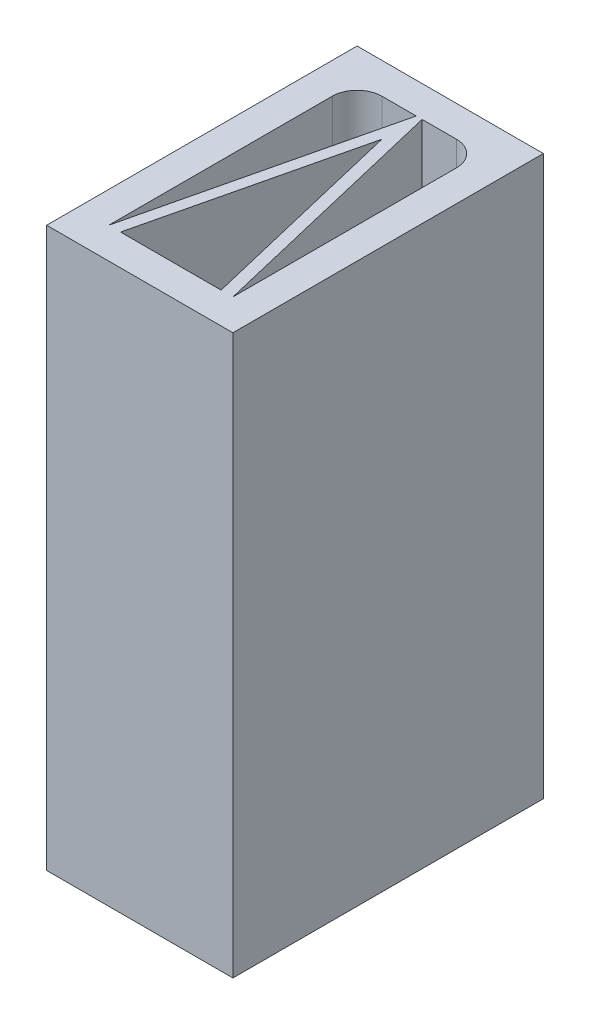
from build123d import *

# Parameters (mm, degrees)
SKETCH1_W           = 15
SKETCH1_H           = 25
SKETCH1_W_2         = 10
SKETCH1_H_2         = 20
BOSS_EXTRUDE1_DEPTH = 45
BOSS_EXTRUDE4_DEPTH = 45
FILLET2_R           = 2


with BuildPart() as part:
    # Sketch1 → Boss-Extrude1 (new body)
    with BuildSketch(Plane(origin=(0, 0, 0), x_dir=(1, 0, 0), z_dir=(0, 1, 0))):
        with Locations((7.5, 12.5)):
            Rectangle(SKETCH1_W, SKETCH1_H)
        with Locations((7.5, 12.5)):
            Rectangle(SKETCH1_W_2, SKETCH1_H_2, mode=Mode.SUBTRACT)
    extrude(amount=BOSS_EXTRUDE1_DEPTH)

    # Sketch3 → Boss-Extrude4 (add, through all)
    with BuildSketch(Plane.XZ):
        Polygon((12.5, -2.5), (7.5, -23.5), (2.5, -2.5), (3.452380952, -2.5), (7.5, -19.5), (11.547619048, -2.5), align=None)
    extrude(amount=-BOSS_EXTRUDE4_DEPTH)

    # Fillet2
    fillet2_edges = [part.edges().sort_by_distance(p)[0] for p in [
        (2.5, 22.5, -22.5),
        (12.5, 22.5, -22.5),
    ]]
    fillet(fillet2_edges, radius=FILLET2_R)


solid = part.part
